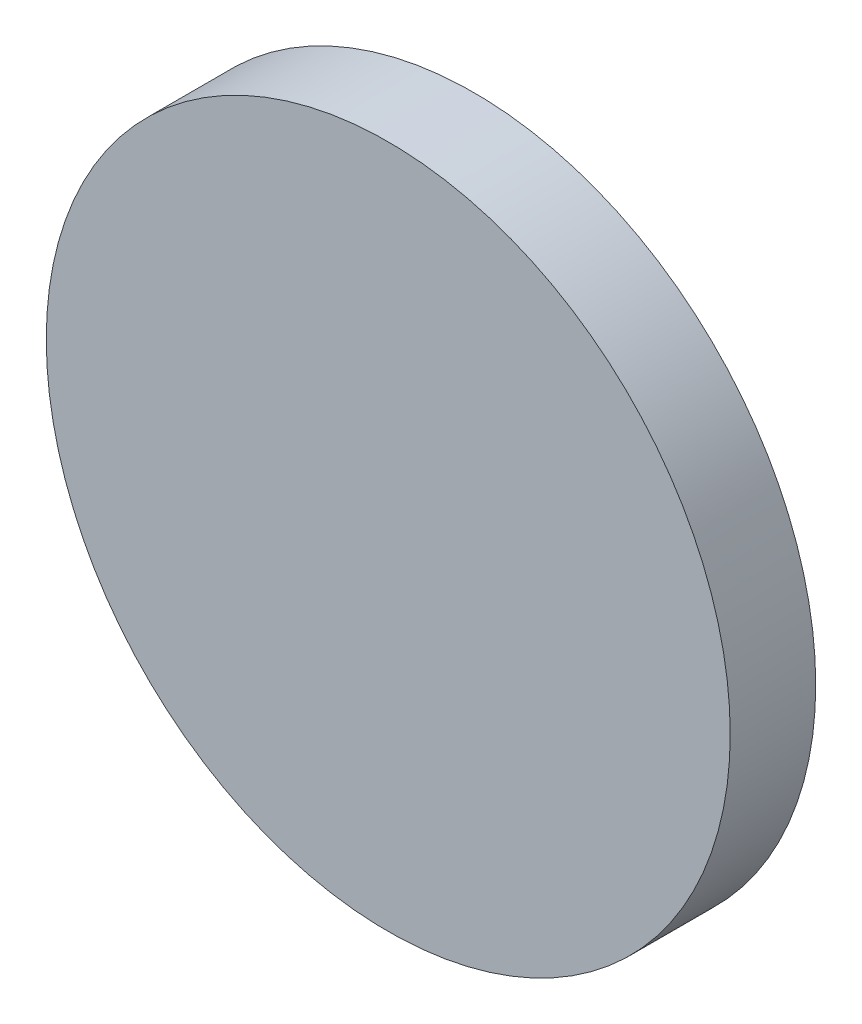
from build123d import *

# Parameters (mm, degrees)
SKETCH1_R           = 40
BOSS_EXTRUDE1_DEPTH = 10


with BuildPart() as part:
    # Sketch1 → Boss-Extrude1 (new body)
    with BuildSketch(Plane.XY):
        Circle(SKETCH1_R)
    extrude(amount=BOSS_EXTRUDE1_DEPTH)


solid = part.part
